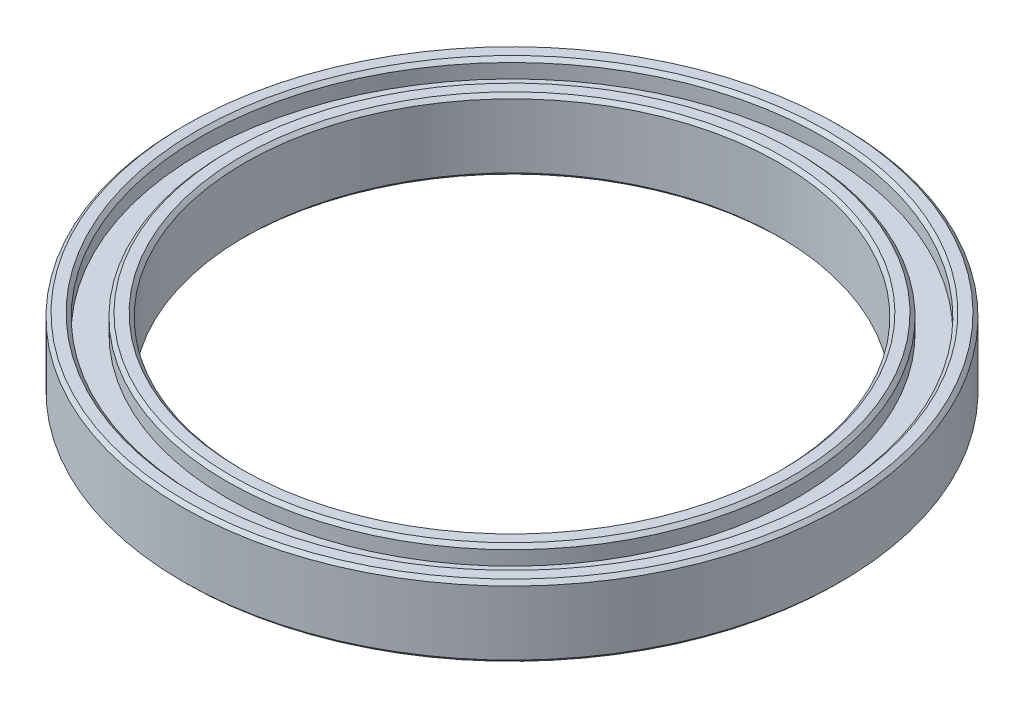
from build123d import *

# Parameters (mm, degrees)
SKETCH1_R           = 18.5
SKETCH1_R_2         = 15
BOSS_EXTRUDE1_DEPTH = 4
SKETCH2_R           = 17.5
SKETCH2_R_2         = 16
CUT_EXTRUDE1_DEPTH  = 1
CUT_EXTRUDE2_START  = -1
SKETCH3_R           = 17.5
SKETCH3_R_2         = 16
CUT_EXTRUDE2_DEPTH  = 1
CHAMFER1_SIZE       = 0.2


with BuildPart() as part:
    # Sketch1 → Boss-Extrude1 (new body)
    with BuildSketch(Plane(origin=(0, 0, 0), x_dir=(1, 0, 0), z_dir=(0, 1, 0))):
        with Locations(Location((0, 0, 0), (0, 0, 270))):
            Circle(SKETCH1_R)
        with Locations(Location((0, 0, 0), (0, 0, 270))):
            Circle(SKETCH1_R_2, mode=Mode.SUBTRACT)
    extrude(amount=BOSS_EXTRUDE1_DEPTH)

    # Sketch2 → Cut-Extrude1 (cut)
    with BuildSketch(Plane(origin=(0, 4, 0), x_dir=(1, 0, 0), z_dir=(0, 1, 0))):
        with Locations(Location((0, 0, 0), (0, 0, 270))):
            Circle(SKETCH2_R)
        with Locations(Location((0, 0, 0), (0, 0, 270))):
            Circle(SKETCH2_R_2, mode=Mode.SUBTRACT)
    extrude(amount=-CUT_EXTRUDE1_DEPTH, mode=Mode.SUBTRACT)

    # Sketch3 → Cut-Extrude2 (cut)
    with BuildSketch(Plane.XZ.offset(CUT_EXTRUDE2_START)):
        with Locations(Location((0, 0, 0), (0, 0, 90))):
            Circle(SKETCH3_R)
        with Locations(Location((0, 0, 0), (0, 0, 90))):
            Circle(SKETCH3_R_2, mode=Mode.SUBTRACT)
    extrude(amount=CUT_EXTRUDE2_DEPTH, mode=Mode.SUBTRACT)

    # Chamfer1
    chamfer1_edges = [part.edges().sort_by_distance(p)[0] for p in [
        (0, 4, -17.5),
        (0, 4, -16),
        (0, 0, -18.5),
        (0, 0, -17.5),
        (0, 0, -16),
        (0, 4, -18.5),
        (0, 0, -15),
        (0, 4, -15),
    ]]
    chamfer(chamfer1_edges, length=CHAMFER1_SIZE)


solid = part.part
